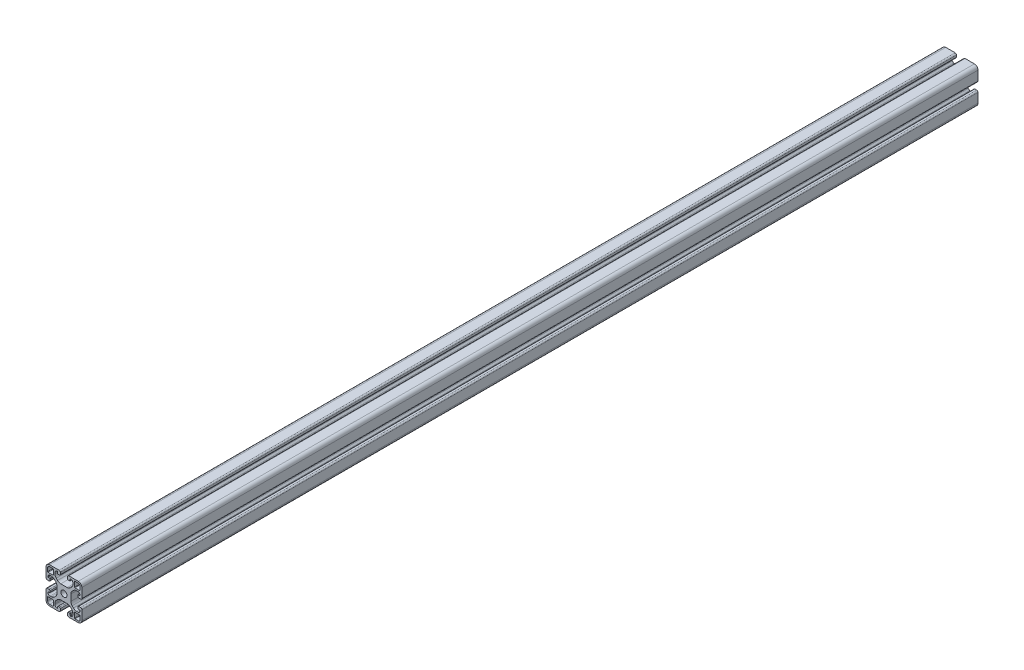
from build123d import *

# Parameters (mm, degrees)
SKETCH1_R          = 3.4
BASE_EXTRUDE_DEPTH = 1000


with BuildPart() as part:
    # Sketch1 → Base-Extrude (new body)
    with BuildSketch(Plane.XY):
        with BuildLine():
            Line((226.84498689, 367.654619736), (226.84498689, 357.154619736))
            ThreePointArc((226.84498689, 357.154619736), (227.284326718, 356.093959564), (228.34498689, 355.654619736))
            Line((228.34498689, 355.654619736), (230.34498689, 355.654619736))
            ThreePointArc((230.34498689, 355.654619736), (231.052093671, 355.947512955), (231.34498689, 356.654619736))
            Line((231.34498689, 356.654619736), (231.34498689, 358.154619736))
            ThreePointArc((231.34498689, 358.154619736), (231.19854028, 358.508173127), (230.84498689, 358.654619736))
            Line((230.84498689, 358.654619736), (229.34498689, 358.654619736))
            ThreePointArc((229.34498689, 358.654619736), (228.991433499, 358.801066345), (228.84498689, 359.154619736))
            ThreePointArc((228.84498689, 359.154619736), (229.577219937, 360.922386689), (231.34498689, 361.654619736))
            Line((231.34498689, 361.654619736), (232.652598734, 361.654619736))
            ThreePointArc((232.652598734, 361.654619736), (234.566015896, 361.274017399), (236.18813264, 360.190153642))
            Line((236.18813264, 360.190153642), (237.630520795, 358.747765487))
            ThreePointArc((237.630520795, 358.747765487), (238.714384552, 357.125648743), (239.09498689, 355.212231581))
            Line((239.09498689, 355.212231581), (239.09498689, 351.654619736))
            Line((239.09498689, 351.654619736), (239.09498689, 348.097007892))
            ThreePointArc((239.09498689, 348.097007892), (238.714384552, 346.18359073), (237.630520795, 344.561473986))
            Line((237.630520795, 344.561473986), (236.18813264, 343.11908583))
            ThreePointArc((236.18813264, 343.11908583), (234.566015896, 342.035222074), (232.652598734, 341.654619736))
            Line((232.652598734, 341.654619736), (231.34498689, 341.654619736))
            ThreePointArc((231.34498689, 341.654619736), (229.577219937, 342.386852783), (228.84498689, 344.154619736))
            ThreePointArc((228.84498689, 344.154619736), (228.991433499, 344.508173127), (229.34498689, 344.654619736))
            Line((229.34498689, 344.654619736), (230.84498689, 344.654619736))
            ThreePointArc((230.84498689, 344.654619736), (231.19854028, 344.801066346), (231.34498689, 345.154619736))
            Line((231.34498689, 345.154619736), (231.34498689, 346.654619736))
            ThreePointArc((231.34498689, 346.654619736), (231.052093671, 347.361726517), (230.34498689, 347.654619736))
            Line((230.34498689, 347.654619736), (228.34498689, 347.654619736))
            ThreePointArc((228.34498689, 347.654619736), (227.284326718, 347.215279908), (226.84498689, 346.154619736))
            Line((226.84498689, 346.154619736), (226.84498689, 335.654619736))
            ThreePointArc((226.84498689, 335.654619736), (228.016559765, 332.826192611), (230.84498689, 331.654619736))
            Line((230.84498689, 331.654619736), (241.34498689, 331.654619736))
            ThreePointArc((241.34498689, 331.654619736), (242.405647061, 332.093959564), (242.84498689, 333.154619736))
            Line((242.84498689, 333.154619736), (242.84498689, 335.154619736))
            ThreePointArc((242.84498689, 335.154619736), (242.552093671, 335.861726517), (241.84498689, 336.154619736))
            Line((241.84498689, 336.154619736), (240.34498689, 336.154619736))
            ThreePointArc((240.34498689, 336.154619736), (239.991433499, 336.008173127), (239.84498689, 335.654619736))
            Line((239.84498689, 335.654619736), (239.84498689, 334.154619736))
            ThreePointArc((239.84498689, 334.154619736), (239.69854028, 333.801066346), (239.34498689, 333.654619736))
            ThreePointArc((239.34498689, 333.654619736), (237.577219937, 334.386852783), (236.84498689, 336.154619736))
            Line((236.84498689, 336.154619736), (236.84498689, 337.462231581))
            ThreePointArc((236.84498689, 337.462231581), (237.225589227, 339.375648743), (238.309452984, 340.997765487))
            Line((238.309452984, 340.997765487), (239.751841139, 342.440153642))
            ThreePointArc((239.751841139, 342.440153642), (241.373957883, 343.524017399), (243.287375045, 343.904619736))
            Line((243.287375045, 343.904619736), (246.84498689, 343.904619736))
            Line((246.84498689, 343.904619736), (250.402598734, 343.904619736))
            ThreePointArc((250.402598734, 343.904619736), (252.316015896, 343.524017399), (253.93813264, 342.440153642))
            Line((253.93813264, 342.440153642), (255.380520795, 340.997765487))
            ThreePointArc((255.380520795, 340.997765487), (256.464384552, 339.375648743), (256.84498689, 337.462231581))
            Line((256.84498689, 337.462231581), (256.84498689, 336.154619736))
            ThreePointArc((256.84498689, 336.154619736), (256.112753842, 334.386852783), (254.34498689, 333.654619736))
            ThreePointArc((254.34498689, 333.654619736), (253.991433499, 333.801066346), (253.84498689, 334.154619736))
            Line((253.84498689, 334.154619736), (253.84498689, 335.654619736))
            ThreePointArc((253.84498689, 335.654619736), (253.69854028, 336.008173127), (253.34498689, 336.154619736))
            Line((253.34498689, 336.154619736), (251.84498689, 336.154619736))
            ThreePointArc((251.84498689, 336.154619736), (251.137880108, 335.861726517), (250.84498689, 335.154619736))
            Line((250.84498689, 335.154619736), (250.84498689, 333.154619736))
            ThreePointArc((250.84498689, 333.154619736), (251.284326718, 332.093959564), (252.34498689, 331.654619736))
            Line((252.34498689, 331.654619736), (262.84498689, 331.654619736))
            ThreePointArc((262.84498689, 331.654619736), (265.673414014, 332.826192611), (266.84498689, 335.654619736))
            Line((266.84498689, 335.654619736), (266.84498689, 346.154619736))
            ThreePointArc((266.84498689, 346.154619736), (266.405647061, 347.215279908), (265.34498689, 347.654619736))
            Line((265.34498689, 347.654619736), (263.34498689, 347.654619736))
            ThreePointArc((263.34498689, 347.654619736), (262.637880108, 347.361726517), (262.34498689, 346.654619736))
            Line((262.34498689, 346.654619736), (262.34498689, 345.154619736))
            ThreePointArc((262.34498689, 345.154619736), (262.491433499, 344.801066346), (262.84498689, 344.654619736))
            Line((262.84498689, 344.654619736), (264.34498689, 344.654619736))
            ThreePointArc((264.34498689, 344.654619736), (264.69854028, 344.508173127), (264.84498689, 344.154619736))
            ThreePointArc((264.84498689, 344.154619736), (264.112753842, 342.386852783), (262.34498689, 341.654619736))
            Line((262.34498689, 341.654619736), (261.037375045, 341.654619736))
            ThreePointArc((261.037375045, 341.654619736), (259.123957883, 342.035222074), (257.501841139, 343.11908583))
            Line((257.501841139, 343.11908583), (256.059452984, 344.561473986))
            ThreePointArc((256.059452984, 344.561473986), (254.975589227, 346.18359073), (254.59498689, 348.097007892))
            Line((254.59498689, 348.097007892), (254.59498689, 351.654619736))
            Line((254.59498689, 351.654619736), (254.59498689, 355.212231581))
            ThreePointArc((254.59498689, 355.212231581), (254.975589227, 357.125648743), (256.059452984, 358.747765487))
            Line((256.059452984, 358.747765487), (257.501841139, 360.190153642))
            ThreePointArc((257.501841139, 360.190153642), (259.123957883, 361.274017399), (261.037375045, 361.654619736))
            Line((261.037375045, 361.654619736), (262.34498689, 361.654619736))
            ThreePointArc((262.34498689, 361.654619736), (264.112753842, 360.922386689), (264.84498689, 359.154619736))
            ThreePointArc((264.84498689, 359.154619736), (264.69854028, 358.801066345), (264.34498689, 358.654619736))
            Line((264.34498689, 358.654619736), (262.84498689, 358.654619736))
            ThreePointArc((262.84498689, 358.654619736), (262.491433499, 358.508173127), (262.34498689, 358.154619736))
            Line((262.34498689, 358.154619736), (262.34498689, 356.654619736))
            ThreePointArc((262.34498689, 356.654619736), (262.637880108, 355.947512955), (263.34498689, 355.654619736))
            Line((263.34498689, 355.654619736), (265.34498689, 355.654619736))
            ThreePointArc((265.34498689, 355.654619736), (266.405647061, 356.093959564), (266.84498689, 357.154619736))
            Line((266.84498689, 357.154619736), (266.84498689, 367.654619736))
            ThreePointArc((266.84498689, 367.654619736), (265.673414014, 370.483046861), (262.84498689, 371.654619736))
            Line((262.84498689, 371.654619736), (252.34498689, 371.654619736))
            ThreePointArc((252.34498689, 371.654619736), (251.284326718, 371.215279908), (250.84498689, 370.154619736))
            Line((250.84498689, 370.154619736), (250.84498689, 368.154619736))
            ThreePointArc((250.84498689, 368.154619736), (251.137880108, 367.447512955), (251.84498689, 367.154619736))
            Line((251.84498689, 367.154619736), (253.34498689, 367.154619736))
            ThreePointArc((253.34498689, 367.154619736), (253.69854028, 367.301066345), (253.84498689, 367.654619736))
            Line((253.84498689, 367.654619736), (253.84498689, 369.154619736))
            ThreePointArc((253.84498689, 369.154619736), (253.991433499, 369.508173127), (254.34498689, 369.654619736))
            ThreePointArc((254.34498689, 369.654619736), (256.112753842, 368.922386689), (256.84498689, 367.154619736))
            Line((256.84498689, 367.154619736), (256.84498689, 365.847007892))
            ThreePointArc((256.84498689, 365.847007892), (256.464384552, 363.93359073), (255.380520795, 362.311473986))
            Line((255.380520795, 362.311473986), (253.93813264, 360.86908583))
            ThreePointArc((253.93813264, 360.86908583), (252.316015896, 359.785222074), (250.402598734, 359.404619736))
            Line((250.402598734, 359.404619736), (246.84498689, 359.404619736))
            Line((246.84498689, 359.404619736), (243.287375045, 359.404619736))
            ThreePointArc((243.287375045, 359.404619736), (241.373957883, 359.785222074), (239.751841139, 360.86908583))
            Line((239.751841139, 360.86908583), (238.309452984, 362.311473986))
            ThreePointArc((238.309452984, 362.311473986), (237.225589227, 363.93359073), (236.84498689, 365.847007892))
            Line((236.84498689, 365.847007892), (236.84498689, 367.154619736))
            ThreePointArc((236.84498689, 367.154619736), (237.577219937, 368.922386689), (239.34498689, 369.654619736))
            ThreePointArc((239.34498689, 369.654619736), (239.69854028, 369.508173127), (239.84498689, 369.154619736))
            Line((239.84498689, 369.154619736), (239.84498689, 367.654619736))
            ThreePointArc((239.84498689, 367.654619736), (239.991433499, 367.301066345), (240.34498689, 367.154619736))
            Line((240.34498689, 367.154619736), (241.84498689, 367.154619736))
            ThreePointArc((241.84498689, 367.154619736), (242.552093671, 367.447512955), (242.84498689, 368.154619736))
            Line((242.84498689, 368.154619736), (242.84498689, 370.154619736))
            ThreePointArc((242.84498689, 370.154619736), (242.405647061, 371.215279908), (241.34498689, 371.654619736))
            Line((241.34498689, 371.654619736), (230.84498689, 371.654619736))
            ThreePointArc((230.84498689, 371.654619736), (228.016559765, 370.483046861), (226.84498689, 367.654619736))
        make_face()
        with Locations((246.84498689, 351.654619736)):
            Circle(SKETCH1_R, mode=Mode.SUBTRACT)
        with BuildLine():
            Line((235.04498689, 333.954619736), (235.04498689, 339.354619736))
            ThreePointArc((235.04498689, 339.354619736), (234.89854028, 339.708173127), (234.54498689, 339.854619736))
            Line((234.54498689, 339.854619736), (229.14498689, 339.854619736))
            ThreePointArc((229.14498689, 339.854619736), (228.791433499, 339.708173127), (228.64498689, 339.354619736))
            Line((228.64498689, 339.354619736), (228.64498689, 335.654619736))
            ThreePointArc((228.64498689, 335.654619736), (229.289351971, 334.098984817), (230.84498689, 333.454619736))
            Line((230.84498689, 333.454619736), (234.54498689, 333.454619736))
            ThreePointArc((234.54498689, 333.454619736), (234.89854028, 333.601066346), (235.04498689, 333.954619736))
        make_face(mode=Mode.SUBTRACT)
        with BuildLine():
            Line((229.14498689, 363.454619736), (234.54498689, 363.454619736))
            ThreePointArc((234.54498689, 363.454619736), (234.89854028, 363.601066345), (235.04498689, 363.954619736))
            Line((235.04498689, 363.954619736), (235.04498689, 369.354619736))
            ThreePointArc((235.04498689, 369.354619736), (234.89854028, 369.708173127), (234.54498689, 369.854619736))
            Line((234.54498689, 369.854619736), (230.84498689, 369.854619736))
            ThreePointArc((230.84498689, 369.854619736), (229.289351971, 369.210254655), (228.64498689, 367.654619736))
            Line((228.64498689, 367.654619736), (228.64498689, 363.954619736))
            ThreePointArc((228.64498689, 363.954619736), (228.791433499, 363.601066345), (229.14498689, 363.454619736))
        make_face(mode=Mode.SUBTRACT)
        with BuildLine():
            Line((264.54498689, 339.854619736), (259.14498689, 339.854619736))
            ThreePointArc((259.14498689, 339.854619736), (258.791433499, 339.708173127), (258.64498689, 339.354619736))
            Line((258.64498689, 339.354619736), (258.64498689, 333.954619736))
            ThreePointArc((258.64498689, 333.954619736), (258.791433499, 333.601066346), (259.14498689, 333.454619736))
            Line((259.14498689, 333.454619736), (262.84498689, 333.454619736))
            ThreePointArc((262.84498689, 333.454619736), (264.400621808, 334.098984817), (265.04498689, 335.654619736))
            Line((265.04498689, 335.654619736), (265.04498689, 339.354619736))
            ThreePointArc((265.04498689, 339.354619736), (264.89854028, 339.708173127), (264.54498689, 339.854619736))
        make_face(mode=Mode.SUBTRACT)
        with BuildLine():
            Line((258.64498689, 369.354619736), (258.64498689, 363.954619736))
            ThreePointArc((258.64498689, 363.954619736), (258.791433499, 363.601066346), (259.14498689, 363.454619736))
            Line((259.14498689, 363.454619736), (264.54498689, 363.454619736))
            ThreePointArc((264.54498689, 363.454619736), (264.89854028, 363.601066346), (265.04498689, 363.954619736))
            Line((265.04498689, 363.954619736), (265.04498689, 367.654619736))
            ThreePointArc((265.04498689, 367.654619736), (264.400621808, 369.210254655), (262.84498689, 369.854619736))
            Line((262.84498689, 369.854619736), (259.14498689, 369.854619736))
            ThreePointArc((259.14498689, 369.854619736), (258.791433499, 369.708173127), (258.64498689, 369.354619736))
        make_face(mode=Mode.SUBTRACT)
    extrude(amount=BASE_EXTRUDE_DEPTH)


solid = part.part
